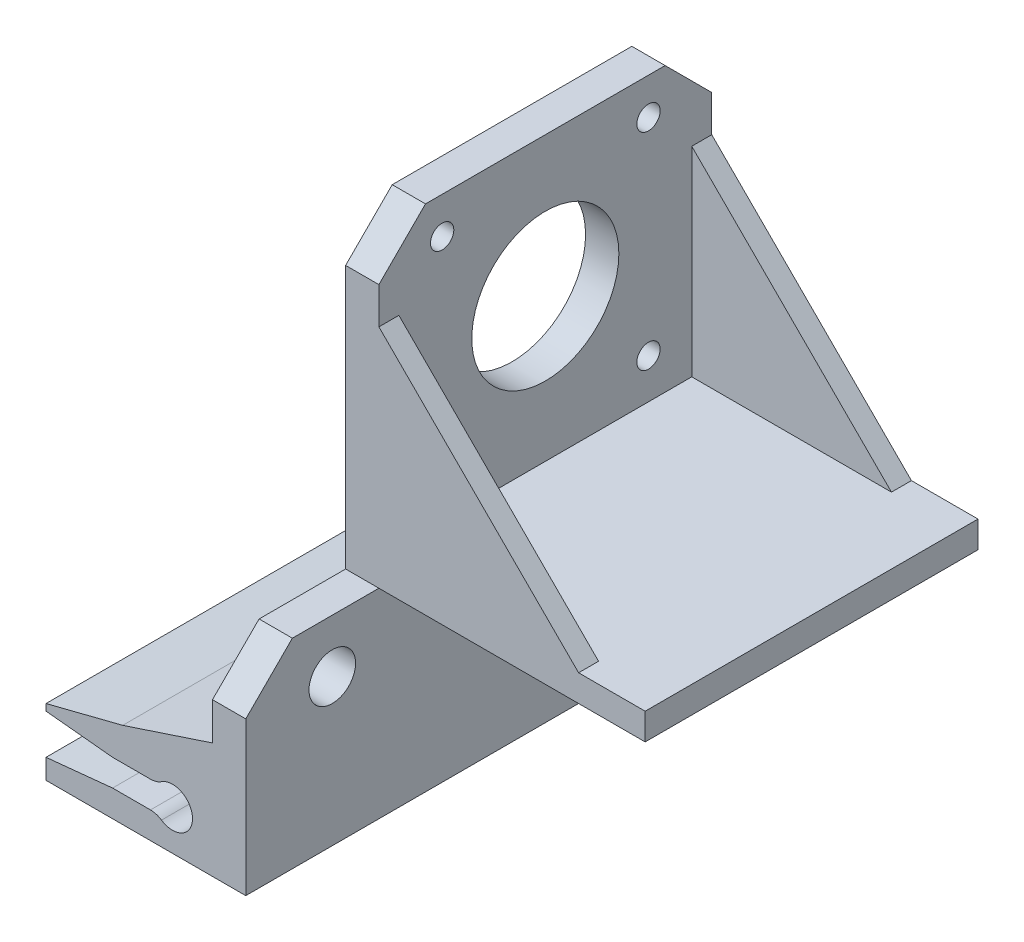
from build123d import *

# Parameters (mm, degrees)
SKETCH1_W           = 50
SKETCH1_H           = 46.5
SKETCH1_R           = 1.75
BOSS_EXTRUDE1_DEPTH = 5
SKETCH2_R           = 11.05
CUT_EXTRUDE1_DEPTH  = 5
SKETCH3_W           = 50
SKETCH3_H           = 4
BOSS_EXTRUDE2_DEPTH = 40
RIB1_REACH          = 73.939
SKETCH4_WALL_W      = 188.304827768
SKETCH4_WALL_H      = 3
SKETCH5_W           = 5
SKETCH5_H           = 50
BOSS_EXTRUDE3_DEPTH = 27
SKETCH8_W           = 5
SKETCH8_H           = 27
BOSS_EXTRUDE5_DEPTH = 20
SKETCH9_W           = 5
SKETCH9_H           = 90
BOSS_EXTRUDE6_DEPTH = 3
BOSS_EXTRUDE7_DEPTH = 90
SKETCH12_R          = 3.5
CUT_EXTRUDE2_DEPTH  = 85.44080767
CHAMFER1_SIZE       = 7
CHAMFER2_SIZE       = 7


with BuildPart() as part:
    # Sketch1 → Boss-Extrude1 (new body)
    with BuildSketch(Plane(origin=(0, 0, 0), x_dir=(0, 0, -1), z_dir=(1, 0, 0))):
        with Locations((0, -2.25)):
            Rectangle(SKETCH1_W, SKETCH1_H)
        with Locations((15.5, 15.5)):
            Circle(SKETCH1_R, mode=Mode.SUBTRACT)
        with Locations(Location((15.5, -15.5, 0), (0, 0, 180))):
            Circle(SKETCH1_R, mode=Mode.SUBTRACT)
        with Locations((-15.5, -15.5)):
            Circle(SKETCH1_R, mode=Mode.SUBTRACT)
        with Locations(Location((-15.5, 15.5, 0), (0, 0, 180))):
            Circle(SKETCH1_R, mode=Mode.SUBTRACT)
    extrude(amount=BOSS_EXTRUDE1_DEPTH)

    # Sketch2 → Cut-Extrude1 (cut)
    with BuildSketch(Plane(origin=(5, 0, 0), x_dir=(0, 0, -1), z_dir=(1, 0, 0))):
        Circle(SKETCH2_R)
    extrude(amount=-CUT_EXTRUDE1_DEPTH, mode=Mode.SUBTRACT)

    # Sketch3 → Boss-Extrude2 (add)
    with BuildSketch(Plane(origin=(5, 0, 0), x_dir=(0, 0, -1), z_dir=(1, 0, 0))):
        with Locations((0, -23.5)):
            Rectangle(SKETCH3_W, SKETCH3_H)
    extrude(amount=BOSS_EXTRUDE2_DEPTH)

    # Sketch4 wall → Rib1 (add, up to next)
    with BuildSketch(Plane(origin=(20, -6.5, -25), x_dir=(-0.707106781187, 0.707106781187, 0), z_dir=(0.707106781187, 0.707106781187, 0)), mode=Mode.PRIVATE) as rib1_sk1:
        with Locations((0, 1.5)):
            Rectangle(SKETCH4_WALL_W, SKETCH4_WALL_H)
    rib1_tool1 = extrude(rib1_sk1.sketch, amount=-RIB1_REACH, mode=Mode.PRIVATE) - part.part
    rib1 = rib1_tool1.solids().sort_by_distance((20, -6.5, -25))[0]
    add(rib1)

    # Mirror1: Rib1 across plane
    add(rib1.mirror(Plane.XY))

    # Sketch5 → Boss-Extrude3 (add)
    with BuildSketch(Plane.XZ.offset(25.5)):
        with Locations((2.5, 0)):
            Rectangle(SKETCH5_W, SKETCH5_H)
    extrude(amount=BOSS_EXTRUDE3_DEPTH)

    # Sketch8 → Boss-Extrude5 (add)
    with BuildSketch(Plane.XY.offset(25)):
        with Locations((2.5, -39)):
            Rectangle(SKETCH8_W, SKETCH8_H)
    boss_extrude5 = extrude(amount=BOSS_EXTRUDE5_DEPTH)

    # Mirror2: Boss-Extrude5 across plane
    add(boss_extrude5.mirror(Plane.XY))

    # Sketch9 → Boss-Extrude6 (add)
    with BuildSketch(Plane.XZ.offset(52.5)):
        with Locations((2.5, 0)):
            Rectangle(SKETCH9_W, SKETCH9_H)
    extrude(amount=BOSS_EXTRUDE6_DEPTH)

    # Sketch10 → Boss-Extrude7 (add)
    with BuildSketch(Plane(origin=(0, 0, -45), x_dir=(-1, 0, 0), z_dir=(0, 0, -1))):
        with BuildLine():
            Line((25.009423753, -46.5), (25.009423753, -45.502387304))
            Line((25.009423753, -45.502387304), (13.489148599, -42.583974938))
            Line((13.489148599, -42.583974938), (0, -38.131335857))
            Line((0, -38.131335857), (0, -45.5))
            Line((0, -45.5), (0, -55.5))
            Line((0, -55.5), (25.009423753, -55.5))
            Line((25.009423753, -55.5), (25.009423753, -52.5))
            Line((25.009423753, -52.5), (15.009423753, -51.5))
            Line((15.009423753, -51.5), (9.31662479, -51.5))
            ThreePointArc((9.31662479, -51.5), (8.450599387, -51.627718677), (7.658312395, -52))
            ThreePointArc((7.658312395, -52), (3, -49.5), (7.658312395, -47))
            ThreePointArc((7.658312395, -47), (8.450599387, -47.372281323), (9.31662479, -47.5))
            Line((9.31662479, -47.5), (15.009423753, -47.5))
            Line((15.009423753, -47.5), (25.009423753, -46.5))
        make_face()
    extrude(amount=-BOSS_EXTRUDE7_DEPTH)

    # Sketch12 → Cut-Extrude2 (cut, through all)
    with BuildSketch(Plane.ZY):
        with Locations((-32, -33.5)):
            Circle(SKETCH12_R)
    cut_extrude2 = extrude(amount=-CUT_EXTRUDE2_DEPTH, mode=Mode.SUBTRACT)

    # Mirror3: Cut-Extrude2 across plane
    add(cut_extrude2.mirror(Plane.XY), mode=Mode.SUBTRACT)

    # Chamfer1
    chamfer1_edges = [part.edges().sort_by_distance(p)[0] for p in [
        (2.5, 21, -25),
    ]]
    chamfer(chamfer1_edges, length=CHAMFER1_SIZE)

    # Chamfer2
    chamfer2_edges = [part.edges().sort_by_distance(p)[0] for p in [
        (2.5, -25.5, 45),
        (2.5, -25.5, -45),
        (2.5, 21, 25),
    ]]
    chamfer(chamfer2_edges, length=CHAMFER2_SIZE)


solid = part.part
